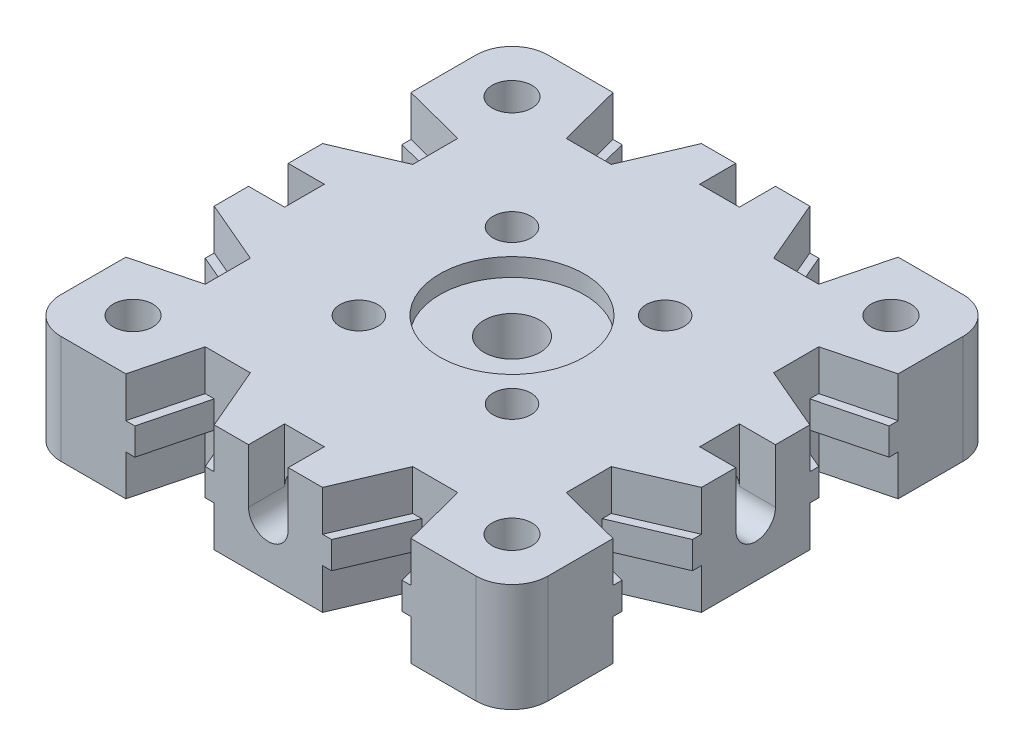
from build123d import *

# Parameters (mm, degrees)
SKETCH_3_W                      = 27
SKETCH_3_H                      = 27
EXTRUDE_1_DEPTH                 = 3
FILLET_1_R                      = 2
SKETCH_4_R                      = 1.1
CUT_EXTRUDE_1_DEPTH             = 6
SKETCH_5_R                      = 1.55
CUT_EXTRUDE_2_DEPTH             = 6
SKETCH_6_R                      = 1.05
CUT_EXTRUDE_3_DEPTH             = 6
PATTERN_CIRCULAR_1_COUNT        = 4
SKETCH_7_R                      = 4
CUT_EXTRUDE_4_DEPTH             = 1
SKETCH_8_W                      = 11.2
SKETCH_8_H                      = 11.2
CUT_EXTRUDE_5_DEPTH             = 2.5
CUT_EXTRUDE_8_DEPTH             = 21.012496096
PATTERN_CIRCULAR_2_COUNT        = 4
PATTERN_CIRCULAR_2_COPY_1_DEPTH = 21.012496096
PATTERN_CIRCULAR_2_COPY_2_DEPTH = 21.012496096
PATTERN_CIRCULAR_2_COPY_3_DEPTH = 21.012496096
SKETCH_12_R                     = 1.1
CUT_EXTRUDE_9_DEPTH             = 8
PATTERN_CIRCULAR_3_COUNT        = 4
EXTRUDE_2_DEPTH                 = 0.75
PATTERN_CIRCULAR_4_COUNT        = 4
PATTERN_CIRCULAR_4_COPY_1_DEPTH = 0.75
PATTERN_CIRCULAR_4_COPY_2_DEPTH = 0.75
PATTERN_CIRCULAR_4_COPY_3_DEPTH = 0.75
SKETCH_22_W                     = 2.2
SKETCH_22_H                     = 3
CUT_EXTRUDE_15_DEPTH            = 2
CUT_EXTRUDE_16_DEPTH            = 3.5
PATTERN_CIRCULAR_8_COUNT        = 4
FILLET_2_R                      = 0.3
SKETCH_25_W                     = 3.009788056
SKETCH_25_H                     = 3.009788056
CUT_EXTRUDE_17_DEPTH            = 2.5
PATTERN_CIRCULAR_10_COUNT       = 4
PATTERN_CIRCULAR_11_COUNT       = 4


with BuildPart() as part:
    # ｽｹｯﾁ3 → ﾎﾞｽ - 押し出し1 (new, symmetric)
    with BuildSketch(Plane(origin=(0, 0, 0), x_dir=(1, 0, 0), z_dir=(0, 1, 0))):
        Rectangle(SKETCH_3_W, SKETCH_3_H)
    extrude(amount=EXTRUDE_1_DEPTH, both=True)

    # ﾌｨﾚｯﾄ1
    fillet_1_edges = [part.edges().sort_by_distance(p)[0] for p in [
        (13.5, 0, 13.5),
        (-13.5, 0, 13.5),
        (-13.5, 0, -13.5),
        (13.5, 0, -13.5),
    ]]
    fillet(fillet_1_edges, radius=FILLET_1_R)

    # ｽｹｯﾁ4 → ｶｯﾄ - 押し出し1 (cut)
    with BuildSketch(Plane(origin=(0, 3, 0), x_dir=(1, 0, 0), z_dir=(0, 1, 0))):
        with Locations(Location((-10.5, 10.5, 0), (0, 0, 270))):
            Circle(SKETCH_4_R)
        with Locations(Location((10.5, 10.5, 0), (0, 0, 270))):
            Circle(SKETCH_4_R)
        with Locations(Location((-10.5, -10.5, 0), (0, 0, 270))):
            Circle(SKETCH_4_R)
        with Locations(Location((10.5, -10.5, 0), (0, 0, 270))):
            Circle(SKETCH_4_R)
    extrude(amount=-CUT_EXTRUDE_1_DEPTH, mode=Mode.SUBTRACT)

    # ｽｹｯﾁ5 → ｶｯﾄ - 押し出し2 (cut)
    with BuildSketch(Plane(origin=(0, 3, 0), x_dir=(1, 0, 0), z_dir=(0, 1, 0))):
        with Locations(Location((0, 0, 0), (0, 0, 270))):
            Circle(SKETCH_5_R)
    extrude(amount=-CUT_EXTRUDE_2_DEPTH, mode=Mode.SUBTRACT)

    # ｽｹｯﾁ6 → ｶｯﾄ - 押し出し3 (cut)
    with BuildSketch(Plane(origin=(0, 3, 0), x_dir=(1, 0, 0), z_dir=(0, 1, 0))):
        with Locations(Location((4.242640687, 4.242640687, 0), (0, 0, 270))):
            Circle(SKETCH_6_R)
    cut_extrude_3 = extrude(amount=-CUT_EXTRUDE_3_DEPTH, mode=Mode.SUBTRACT)

    # 円形ﾊﾟﾀｰﾝ1: ｶｯﾄ - 押し出し3 ×4 about axis
    pattern_circular_1_axis = Axis((0, 0, 0), (0, 1, 0))
    for i in range(1, PATTERN_CIRCULAR_1_COUNT):
        add(cut_extrude_3.rotate(pattern_circular_1_axis, i * 360 / PATTERN_CIRCULAR_1_COUNT), mode=Mode.SUBTRACT)

    # ｽｹｯﾁ7 → ｶｯﾄ - 押し出し4 (cut)
    with BuildSketch(Plane(origin=(0, 3, 0), x_dir=(1, 0, 0), z_dir=(0, 1, 0))):
        with Locations(Location((0, 0, 0), (0, 0, 270))):
            Circle(SKETCH_7_R)
    extrude(amount=-CUT_EXTRUDE_4_DEPTH, mode=Mode.SUBTRACT)

    # ｽｹｯﾁ8 → ｶｯﾄ - 押し出し5 (cut)
    with BuildSketch(Plane.XZ.offset(3)):
        Rectangle(SKETCH_8_W, SKETCH_8_H)
    extrude(amount=-CUT_EXTRUDE_5_DEPTH, mode=Mode.SUBTRACT)

    # ｽｹｯﾁ11 → ｶｯﾄ - 押し出し8 (cut, symmetric)
    with BuildSketch(Plane(origin=(0, 3, 0), x_dir=(1, 0, 0), z_dir=(0, 1, 0))):
        Polygon((-28.082033535, 86.024744916), (3, 13.5), (4.5, 10), (7, 10), (7.9, 13.5), (27.55047658, 89.918520033), (16.532211377, 247.342544779), (-39.100298738, 243.448769662), align=None)
    cut_extrude_8 = extrude(amount=CUT_EXTRUDE_8_DEPTH, both=True, mode=Mode.SUBTRACT)

    # ﾐﾗｰ1: ｶｯﾄ - 押し出し8 across plane
    add(cut_extrude_8.mirror(Plane(origin=(0, 0, 0), x_dir=(0, 0, 1), z_dir=(1, 0, 0))), mode=Mode.SUBTRACT)

    # 円形ﾊﾟﾀｰﾝ2: ｶｯﾄ - 押し出し8 ×4 about axis
    pattern_circular_2_axis = Axis((0, 0, 0), (0, 1, 0))
    for i in range(1, PATTERN_CIRCULAR_2_COUNT):
        add(cut_extrude_8.rotate(pattern_circular_2_axis, i * 360 / PATTERN_CIRCULAR_2_COUNT), mode=Mode.SUBTRACT)

    # 円形ﾊﾟﾀｰﾝ2 copy 1 sketch → 円形ﾊﾟﾀｰﾝ2 copy 1 (cut, symmetric)
    with BuildSketch(Plane.ZX.offset(3)):
        Polygon((-28.082033535, -86.024744916), (3, -13.5), (4.5, -10), (7, -10), (7.9, -13.5), (27.55047658, -89.918520033), (16.532211377, -247.342544779), (-39.100298738, -243.448769662), align=None)
    extrude(amount=PATTERN_CIRCULAR_2_COPY_1_DEPTH, both=True, mode=Mode.SUBTRACT)

    # 円形ﾊﾟﾀｰﾝ2 copy 2 sketch → 円形ﾊﾟﾀｰﾝ2 copy 2 (cut, symmetric)
    with BuildSketch(Plane(origin=(0, 3, 0), x_dir=(1, 0, 0), z_dir=(0, 1, 0))):
        Polygon((-28.082033535, -86.024744916), (3, -13.5), (4.5, -10), (7, -10), (7.9, -13.5), (27.55047658, -89.918520033), (16.532211377, -247.342544779), (-39.100298738, -243.448769662), align=None)
    extrude(amount=PATTERN_CIRCULAR_2_COPY_2_DEPTH, both=True, mode=Mode.SUBTRACT)

    # 円形ﾊﾟﾀｰﾝ2 copy 3 sketch → 円形ﾊﾟﾀｰﾝ2 copy 3 (cut, symmetric)
    with BuildSketch(Plane(origin=(0, 3, 0), x_dir=(0, 0, -1), z_dir=(0, 1, 0))):
        Polygon((-28.082033535, -86.024744916), (3, -13.5), (4.5, -10), (7, -10), (7.9, -13.5), (27.55047658, -89.918520033), (16.532211377, -247.342544779), (-39.100298738, -243.448769662), align=None)
    extrude(amount=PATTERN_CIRCULAR_2_COPY_3_DEPTH, both=True, mode=Mode.SUBTRACT)

    # ｽｹｯﾁ12 → ｶｯﾄ - 押し出し9 (cut)
    with BuildSketch(Plane.XY.offset(13.5)):
        Circle(SKETCH_12_R)
    cut_extrude_9 = extrude(amount=-CUT_EXTRUDE_9_DEPTH, mode=Mode.SUBTRACT)

    # 円形ﾊﾟﾀｰﾝ3: ｶｯﾄ - 押し出し9 ×4 about axis
    pattern_circular_3_axis = Axis((0, 0, 0), (0, 1, 0))
    for i in range(1, PATTERN_CIRCULAR_3_COUNT):
        add(cut_extrude_9.rotate(pattern_circular_3_axis, i * 360 / PATTERN_CIRCULAR_3_COUNT), mode=Mode.SUBTRACT)

    # ｽｹｯﾁ13 → ﾎﾞｽ - 押し出し2 (add, symmetric)
    with BuildSketch(Plane(origin=(0, 0, 0), x_dir=(1, 0, 0), z_dir=(0, 1, 0))):
        Polygon((7.9, 13.5), (7, 10), (6.5, 10), (7.4, 13.5), align=None)
        Polygon((3, 13.5), (3.5, 13.5), (5, 10), (4.5, 10), align=None)
    extrude_2 = extrude(amount=EXTRUDE_2_DEPTH, both=True)

    # ﾐﾗｰ2: ﾎﾞｽ - 押し出し2 across plane
    add(extrude_2.mirror(Plane(origin=(0, 0, 0), x_dir=(0, 0, 1), z_dir=(1, 0, 0))))

    # 円形ﾊﾟﾀｰﾝ4: ﾎﾞｽ - 押し出し2 ×4 about axis
    pattern_circular_4_axis = Axis((0, 0, 0), (0, 1, 0))
    for i in range(1, PATTERN_CIRCULAR_4_COUNT):
        add(extrude_2.rotate(pattern_circular_4_axis, i * 360 / PATTERN_CIRCULAR_4_COUNT))

    # 円形ﾊﾟﾀｰﾝ4 copy 1 sketch → 円形ﾊﾟﾀｰﾝ4 copy 1 (add, symmetric)
    with BuildSketch(Plane.ZX):
        Polygon((7.9, -13.5), (7, -10), (6.5, -10), (7.4, -13.5), align=None)
        Polygon((3, -13.5), (3.5, -13.5), (5, -10), (4.5, -10), align=None)
    extrude(amount=PATTERN_CIRCULAR_4_COPY_1_DEPTH, both=True)

    # 円形ﾊﾟﾀｰﾝ4 copy 2 sketch → 円形ﾊﾟﾀｰﾝ4 copy 2 (add, symmetric)
    with BuildSketch(Plane(origin=(0, 0, 0), x_dir=(1, 0, 0), z_dir=(0, 1, 0))):
        Polygon((7.9, -13.5), (7, -10), (6.5, -10), (7.4, -13.5), align=None)
        Polygon((3, -13.5), (3.5, -13.5), (5, -10), (4.5, -10), align=None)
    extrude(amount=PATTERN_CIRCULAR_4_COPY_2_DEPTH, both=True)

    # 円形ﾊﾟﾀｰﾝ4 copy 3 sketch → 円形ﾊﾟﾀｰﾝ4 copy 3 (add, symmetric)
    with BuildSketch(Plane(origin=(0, 0, 0), x_dir=(0, 0, -1), z_dir=(0, 1, 0))):
        Polygon((7.9, -13.5), (7, -10), (6.5, -10), (7.4, -13.5), align=None)
        Polygon((3, -13.5), (3.5, -13.5), (5, -10), (4.5, -10), align=None)
    extrude(amount=PATTERN_CIRCULAR_4_COPY_3_DEPTH, both=True)

    # ｽｹｯﾁ22 → ｶｯﾄ - 押し出し15 (cut)
    with BuildSketch(Plane.XY.offset(13.5)):
        with Locations((0, 1.5)):
            Rectangle(SKETCH_22_W, SKETCH_22_H)
    cut_extrude_15 = extrude(amount=-CUT_EXTRUDE_15_DEPTH, mode=Mode.SUBTRACT)

    # ｽｹｯﾁ23 → ｶｯﾄ - 押し出し16 (cut)
    with BuildSketch(Plane.XZ.offset(3)):
        with BuildLine():
            Line((-4.4, 8), (-8, 8))
            Line((-8, 8), (-8, 4.4))
            Line((-8, 4.4), (-7.138368238, 4.4))
            ThreePointArc((-7.138368238, 4.4), (-6.293250353, 6.293250353), (-4.4, 7.138368238))
            Line((-4.4, 7.138368238), (-4.4, 8))
        make_face()
    cut_extrude_16 = extrude(amount=-CUT_EXTRUDE_16_DEPTH, mode=Mode.SUBTRACT)

    # 円形ﾊﾟﾀｰﾝ8: ｶｯﾄ - 押し出し16 ×4 about axis
    pattern_circular_8_axis = Axis((0, 0, 0), (0, 1, 0))
    for i in range(1, PATTERN_CIRCULAR_8_COUNT):
        add(cut_extrude_16.rotate(pattern_circular_8_axis, i * 360 / PATTERN_CIRCULAR_8_COUNT), mode=Mode.SUBTRACT)

    # ﾌｨﾚｯﾄ2
    fillet_2_edges = [part.edges().sort_by_distance(p)[0] for p in [
        (-4.4, -1.25, 7.138368238),
        (-7.138368238, -1.25, 4.4),
        (-8, -1.25, 4.4),
        (-8, -1.25, 8),
        (-4.4, -1.25, 8),
        (7.138368238, -1.25, 4.4),
        (4.4, -1.25, 7.138368238),
        (4.4, -1.25, 8),
        (8, -1.25, 8),
        (8, -1.25, 4.4),
        (4.4, -1.25, -7.138368238),
        (7.138368238, -1.25, -4.4),
        (8, -1.25, -4.4),
        (8, -1.25, -8),
        (4.4, -1.25, -8),
        (-7.138368238, -1.25, -4.4),
        (-4.4, -1.25, -7.138368238),
        (-4.4, -1.25, -8),
        (-8, -1.25, -8),
        (-8, -1.25, -4.4),
    ]]
    fillet(fillet_2_edges, radius=FILLET_2_R)

    # ｽｹｯﾁ25 → ｶｯﾄ - 押し出し17 (cut)
    with BuildSketch(Plane.XZ.offset(3)):
        with Locations((-5.904894028, 5.904894028)):
            Rectangle(SKETCH_25_W, SKETCH_25_H)
    cut_extrude_17 = extrude(amount=-CUT_EXTRUDE_17_DEPTH, mode=Mode.SUBTRACT)

    # 円形ﾊﾟﾀｰﾝ10: ｶｯﾄ - 押し出し17 ×4 about axis
    pattern_circular_10_axis = Axis((0, 0, 0), (0, 1, 0))
    for i in range(1, PATTERN_CIRCULAR_10_COUNT):
        add(cut_extrude_17.rotate(pattern_circular_10_axis, i * 360 / PATTERN_CIRCULAR_10_COUNT), mode=Mode.SUBTRACT)

    # 円形ﾊﾟﾀｰﾝ11: ｶｯﾄ - 押し出し15 ×4 about axis
    pattern_circular_11_axis = Axis((0, 0, 0), (0, 1, 0))
    for i in range(1, PATTERN_CIRCULAR_11_COUNT):
        add(cut_extrude_15.rotate(pattern_circular_11_axis, i * 360 / PATTERN_CIRCULAR_11_COUNT), mode=Mode.SUBTRACT)


solid = part.part
